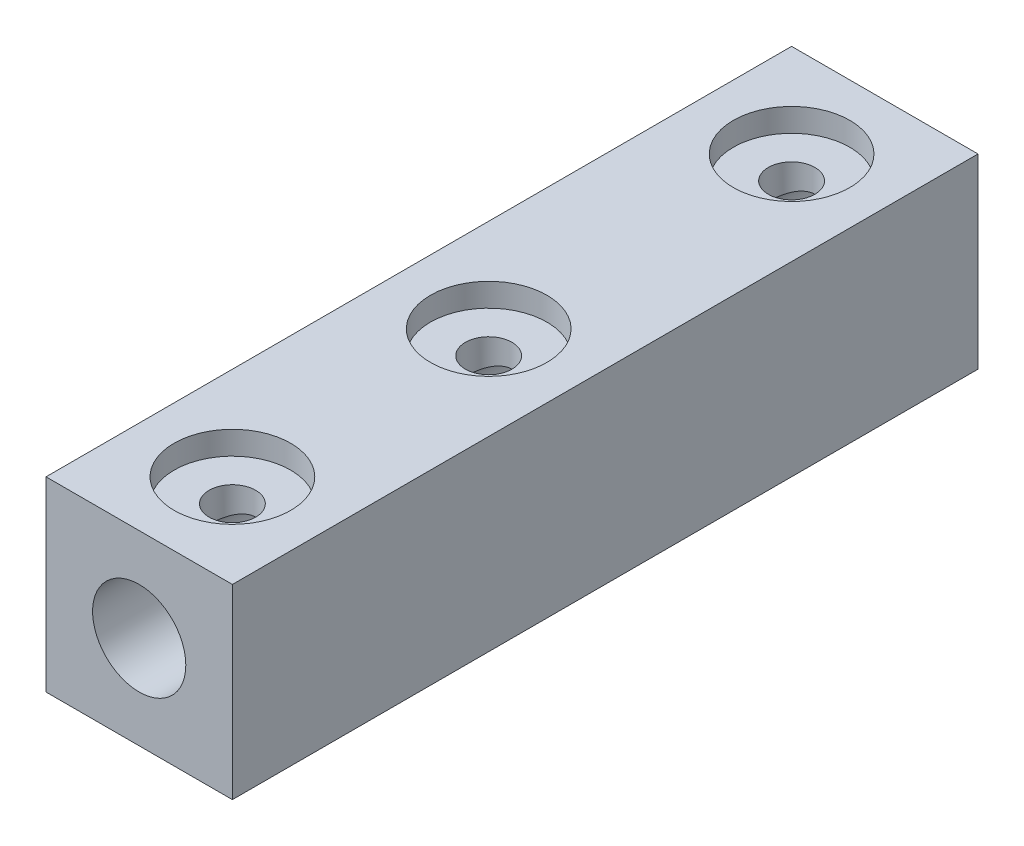
from build123d import *

# Parameters (mm, degrees)
SKETCH18_W                 = 25.4
SKETCH18_H                 = 25.4
BOSS_EXTRUDE3_DEPTH        = 50.8
F_1_2_0_5_DIAMETER_HOLE2_D = 12.7
SKETCH26_R                 = 3.175
CUT_EXTRUDE10_DEPTH        = 12.7
SKETCH27_R                 = 7.9375
CUT_EXTRUDE11_DEPTH        = 3.175
CUT_EXTRUDE12_START        = -12.7
SKETCH28_R                 = 3.175
CUT_EXTRUDE12_DEPTH        = 12.7
CUT_EXTRUDE13_START        = -3.175
SKETCH29_R                 = 7.9375
CUT_EXTRUDE13_DEPTH        = 3.175


with BuildPart() as part:
    # Sketch18 → Boss-Extrude3 (new, symmetric)
    with BuildSketch(Plane.XY):
        Rectangle(SKETCH18_W, SKETCH18_H)
    extrude(amount=BOSS_EXTRUDE3_DEPTH, both=True)

    # 1/2 (0.5) Diameter Hole2 (through all)
    with Locations(Plane.XY.offset(50.8)):
        with Locations((0, 0)):
            Hole(F_1_2_0_5_DIAMETER_HOLE2_D / 2)

    # Sketch26 → Cut-Extrude10 (cut)
    with BuildSketch(Plane(origin=(0, 12.7, 0), x_dir=(1, 0, 0), z_dir=(0, 1, 0))):
        with Locations(Location((0, -38.1, 0), (0, 0, 180))):
            Circle(SKETCH26_R)
        with Locations(Location((0, -3.175, 0), (0, 0, 180))):
            Circle(SKETCH26_R)
        with Locations(Location((0, 38.1, 0), (0, 0, 180))):
            Circle(SKETCH26_R)
    extrude(amount=-CUT_EXTRUDE10_DEPTH, mode=Mode.SUBTRACT)

    # Sketch27 → Cut-Extrude11 (cut)
    with BuildSketch(Plane(origin=(0, 12.7, 0), x_dir=(1, 0, 0), z_dir=(0, 1, 0))):
        with Locations(Location((0, 38.1, 0), (0, 0, 180))):
            Circle(SKETCH27_R)
        with Locations(Location((0, -3.175, 0), (0, 0, 180))):
            Circle(SKETCH27_R)
        with Locations(Location((0, -38.1, 0), (0, 0, 180))):
            Circle(SKETCH27_R)
    extrude(amount=-CUT_EXTRUDE11_DEPTH, mode=Mode.SUBTRACT)

    # Sketch28 → Cut-Extrude12 (cut)
    with BuildSketch(Plane.XZ.offset(12.7).offset(CUT_EXTRUDE12_START)):
        with Locations(Location((0, 3.175, 0), (0, 0, 180))):
            Circle(SKETCH28_R)
    extrude(amount=CUT_EXTRUDE12_DEPTH, mode=Mode.SUBTRACT)

    # Sketch29 → Cut-Extrude13 (cut)
    with BuildSketch(Plane(origin=(0, -12.7, 0), x_dir=(-1, 0, 0), z_dir=(0, -1, 0)).offset(CUT_EXTRUDE13_START)):
        with Locations((0, -3.175)):
            Circle(SKETCH29_R)
    extrude(amount=CUT_EXTRUDE13_DEPTH, mode=Mode.SUBTRACT)


solid = part.part
